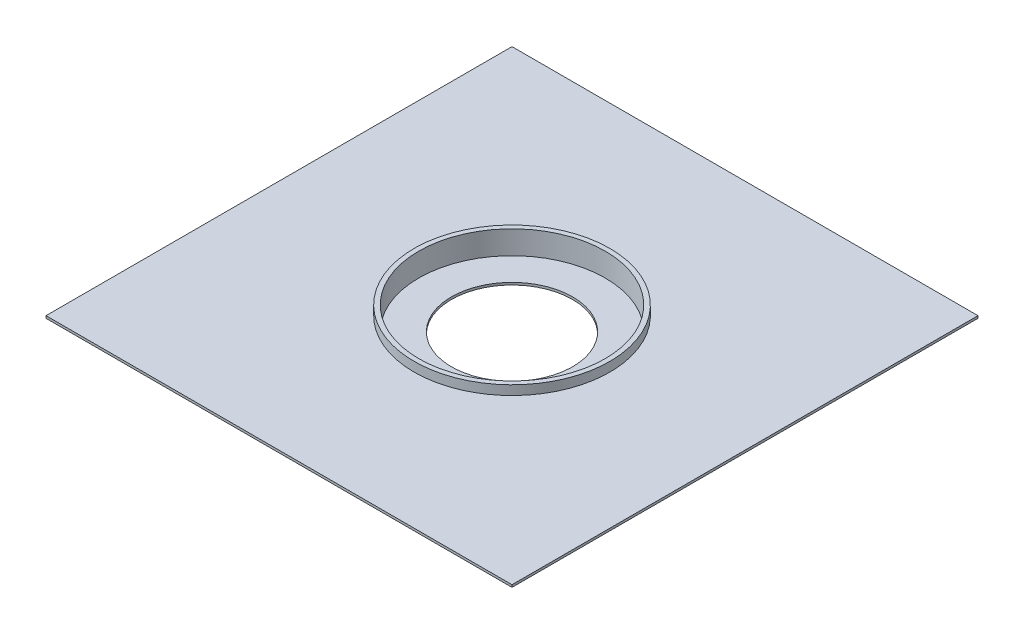
from build123d import *

# Parameters (mm, degrees)
SKETCH1_W                = 200
SKETCH1_H                = 200
BOSS_EXTRUDE3_DEPTH      = 1
SKETCH10_R               = 40
CUT_EXTRUDE2_DEPTH       = 1
BOSS_EXTRUDE6_DEPTH      = 5
BOSS_EXTRUDE6_DEPTH_BACK = 5
SKETCH13_R               = 42
SKETCH13_R_2             = 40
SKETCH14_R               = 42
SKETCH14_R_2             = 26
BOSS_EXTRUDE7_DEPTH      = 1


with BuildPart() as part:
    # Sketch1 → Boss-Extrude3 (new body)
    with BuildSketch(Plane(origin=(0, 0, 0), x_dir=(1, 0, 0), z_dir=(0, 1, 0))):
        with Locations((100, -100)):
            Rectangle(SKETCH1_W, SKETCH1_H)
    extrude(amount=BOSS_EXTRUDE3_DEPTH)

    # Sketch10 → Cut-Extrude2 (cut)
    with BuildSketch(Plane(origin=(0, 1, 0), x_dir=(1, 0, 0), z_dir=(0, 1, 0))):
        with Locations((100, -100)):
            Circle(SKETCH10_R)
    extrude(amount=-CUT_EXTRUDE2_DEPTH, mode=Mode.SUBTRACT)

    # Sketch13 → Boss-Extrude6 (add, two sides: drawn at the far end of the back side and taken through both)
    with BuildSketch(Plane.XZ.offset(-BOSS_EXTRUDE6_DEPTH_BACK)):
        with Locations((100, 100)):
            Circle(SKETCH13_R)
        with Locations((100, 100)):
            Circle(SKETCH13_R_2, mode=Mode.SUBTRACT)
    extrude(amount=BOSS_EXTRUDE6_DEPTH + BOSS_EXTRUDE6_DEPTH_BACK)

    # Sketch14 → Boss-Extrude7 (add)
    with BuildSketch(Plane.XZ.offset(5)):
        with Locations((100, 100)):
            Circle(SKETCH14_R)
        with Locations((100, 100)):
            Circle(SKETCH14_R_2, mode=Mode.SUBTRACT)
    extrude(amount=BOSS_EXTRUDE7_DEPTH)


solid = part.part
